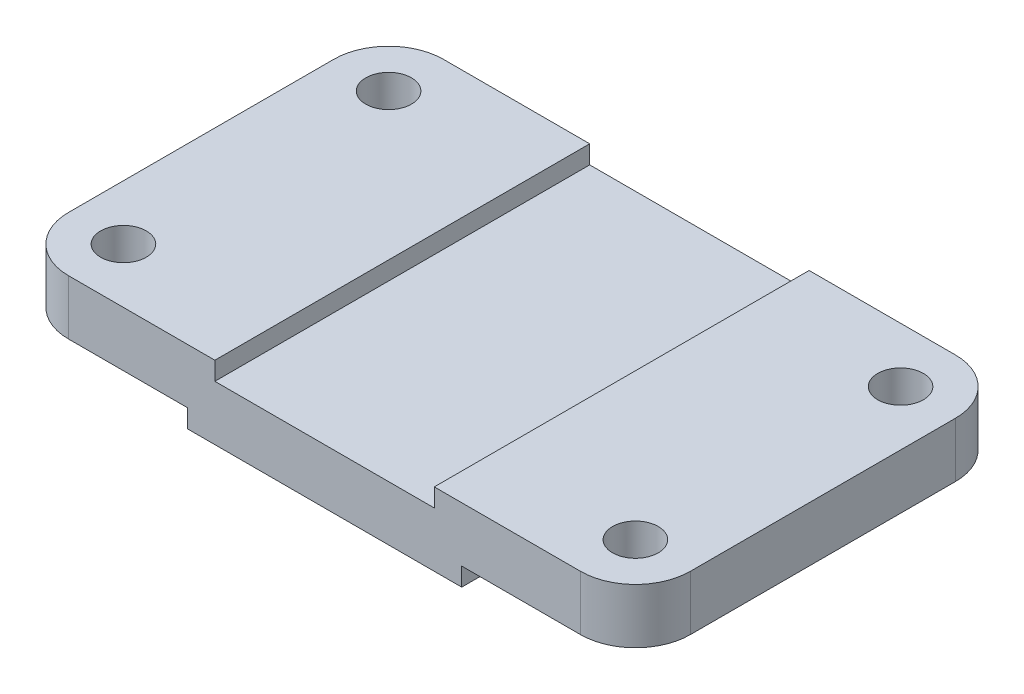
from build123d import *

# Parameters (mm, degrees)
EXTRUDE_1_DEPTH     = 41
FILLET_1_R          = 12
SKETCH_2_R          = 5
CUT_EXTRUDE_1_DEPTH = 82


with BuildPart() as part:
    # 草圖1 → 伸長1 (new, symmetric)
    with BuildSketch(Plane.XY):
        Polygon((-30, 0), (30, 0), (30, 4), (68, 4), (68, 16), (24, 16), (24, 12), (-24, 12), (-24, 16), (-68, 16), (-68, 4), (-30, 4), align=None)
    extrude(amount=EXTRUDE_1_DEPTH, both=True)

    # 圓角1
    fillet_1_edges = [part.edges().sort_by_distance(p)[0] for p in [
        (68, 10, 41),
        (-68, 10, -41),
        (68, 10, -41),
        (-68, 10, 41),
    ]]
    fillet(fillet_1_edges, radius=FILLET_1_R)

    # 草圖2 → 除料-伸長1 (cut, through all)
    with BuildSketch(Plane(origin=(0, 16, 0), x_dir=(-1, 0, 0), z_dir=(0, 1, 0))):
        with Locations((-56, -29)):
            Circle(SKETCH_2_R)
        with Locations((-56, 29)):
            Circle(SKETCH_2_R)
        with Locations((56, -29)):
            Circle(SKETCH_2_R)
        with Locations((56, 29)):
            Circle(SKETCH_2_R)
    extrude(amount=-CUT_EXTRUDE_1_DEPTH, mode=Mode.SUBTRACT)


solid = part.part
